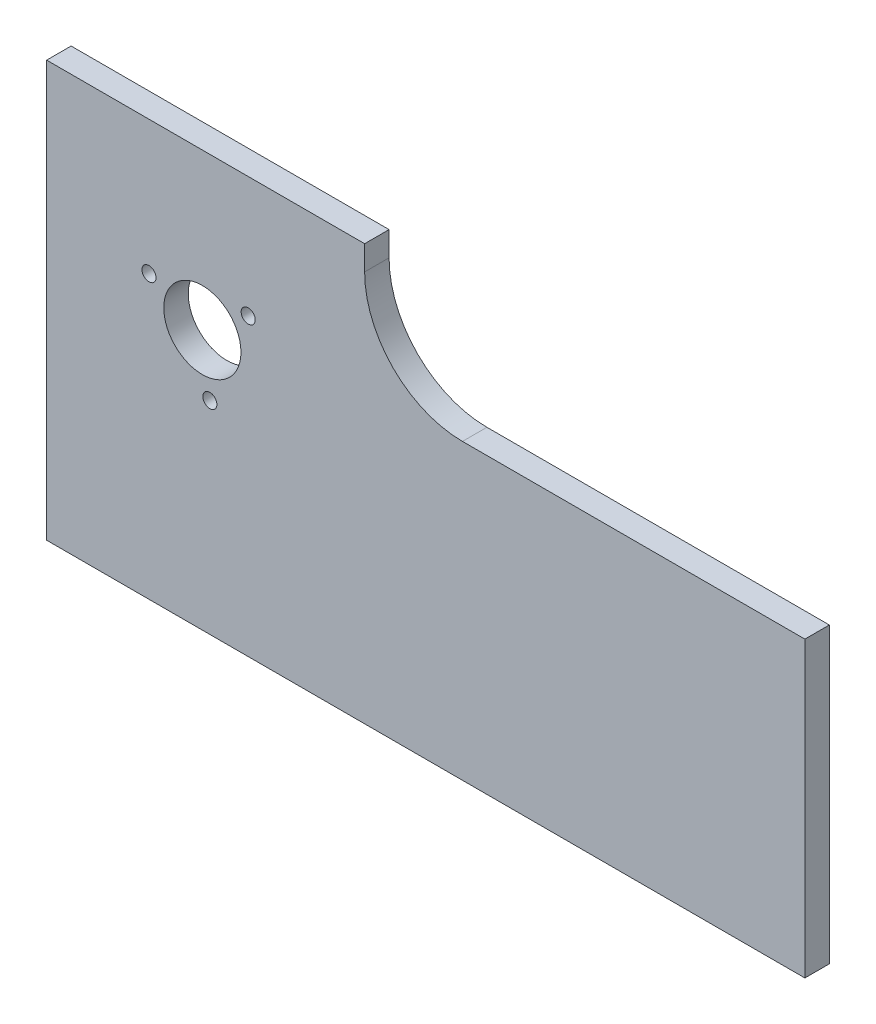
from build123d import *

# Parameters (mm, degrees)
BOSS_EXTRUDE1_DEPTH = 6.35
SKETCH4_R           = 10.0203
SKETCH4_R_2         = 1.8288
CUT_EXTRUDE3_DEPTH  = 154.060029074


with BuildPart() as part:
    # Sketch2 → Boss-Extrude1 (new body)
    with BuildSketch(Plane.XY):
        with BuildLine():
            Line((-82.55, -6.35), (-82.55, 101.6))
            Line((-82.55, 101.6), (0, 101.6))
            Line((0, 101.6), (0, 95.25))
            ThreePointArc((0, 95.25), (7.439487758, 77.289487758), (25.4, 69.85))
            Line((25.4, 69.85), (114.3, 69.85))
            Line((114.3, 69.85), (114.3, -6.35))
            Line((114.3, -6.35), (-82.55, -6.35))
        make_face()
    extrude(amount=BOSS_EXTRUDE1_DEPTH)

    # Sketch4 → Cut-Extrude3 (cut, through all)
    with BuildSketch(Plane.XY.offset(6.35)):
        with Locations((-42.128660063, 61.122671242)):
            Circle(SKETCH4_R)
        with Locations((-30.224747325, 70.249382672)):
            Circle(SKETCH4_R_2)
        with Locations((-55.984580384, 66.868406363)):
            Circle(SKETCH4_R_2)
        with Locations((-40.176652481, 46.250224691)):
            Circle(SKETCH4_R_2)
    extrude(amount=-CUT_EXTRUDE3_DEPTH, mode=Mode.SUBTRACT)


solid = part.part
